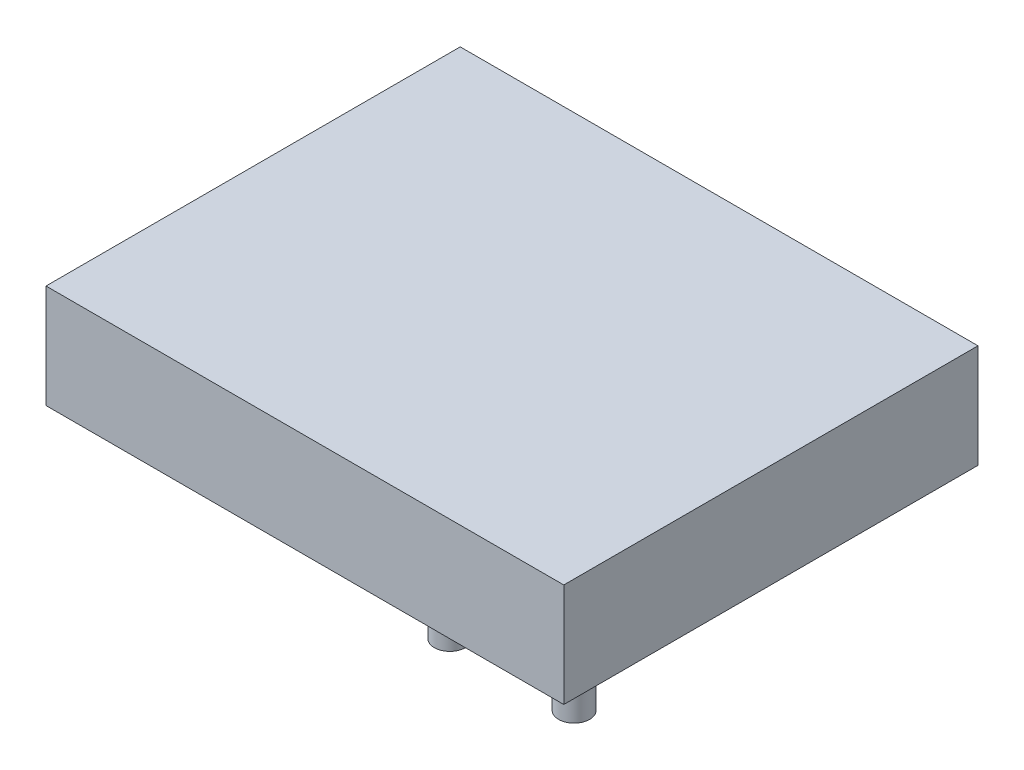
from build123d import *

# Parameters (mm, degrees)
SZKIC1_W                    = 50
SZKIC1_H                    = 10
DODANIE_WYCI_GNI_CIE1_DEPTH = 40
SZKIC2_R                    = 1.5
DODANIE_WYCI_GNI_CIE2_DEPTH = 20


with BuildPart() as part:
    # Szkic1 → Dodanie-wyciągnięcie1 (new body)
    with BuildSketch(Plane.XY):
        Rectangle(SZKIC1_W, SZKIC1_H)
    extrude(amount=DODANIE_WYCI_GNI_CIE1_DEPTH)

    # Szkic2 → Dodanie-wyciągnięcie2 (add)
    with BuildSketch(Plane.XZ.offset(5)):
        with Locations(Location((-6, 20, 0), (0, 0, 90))):
            Circle(SZKIC2_R)
        with Locations(Location((6, 20, 0), (0, 0, 90))):
            Circle(SZKIC2_R)
    extrude(amount=DODANIE_WYCI_GNI_CIE2_DEPTH)


solid = part.part
